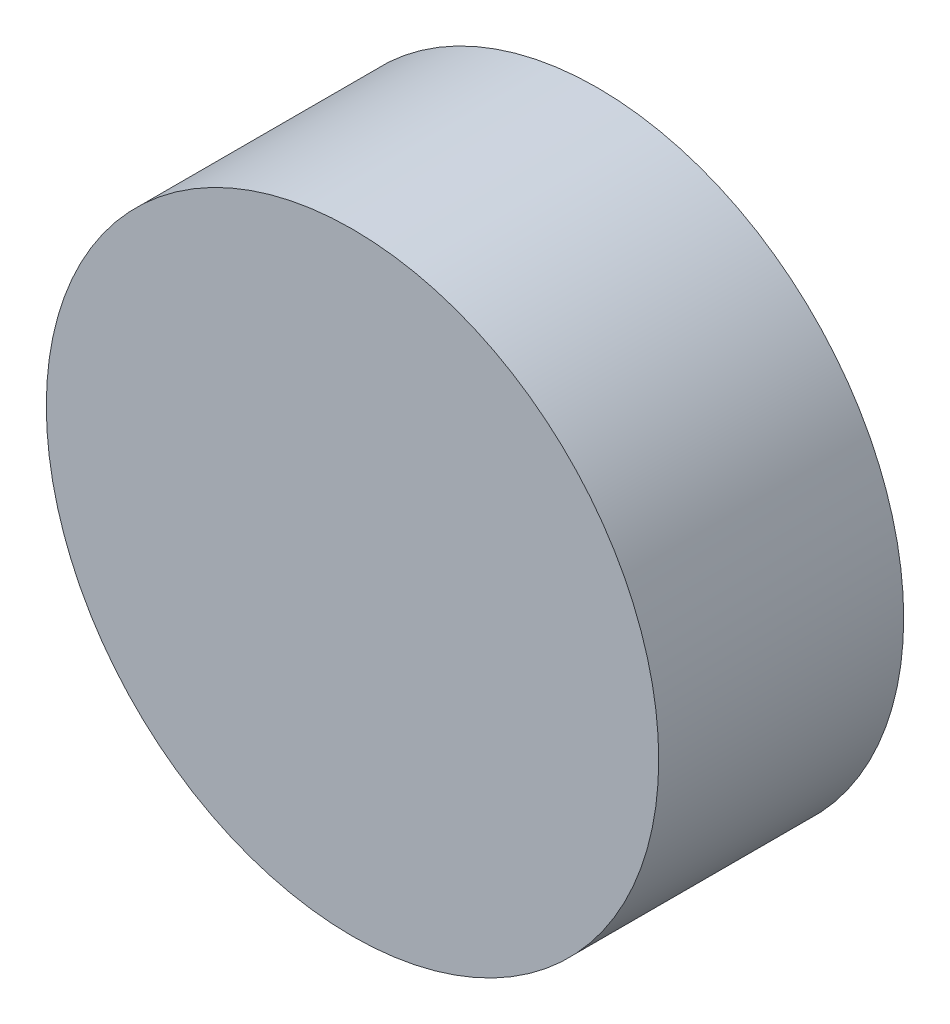
from build123d import *

# Parameters (mm, degrees)
SKETCH1_R           = 2.54
BOSS_EXTRUDE1_DEPTH = 2.032


with BuildPart() as part:
    # Sketch1 → Boss-Extrude1 (new body)
    with BuildSketch(Plane.XY):
        Circle(SKETCH1_R)
    extrude(amount=BOSS_EXTRUDE1_DEPTH)


solid = part.part
